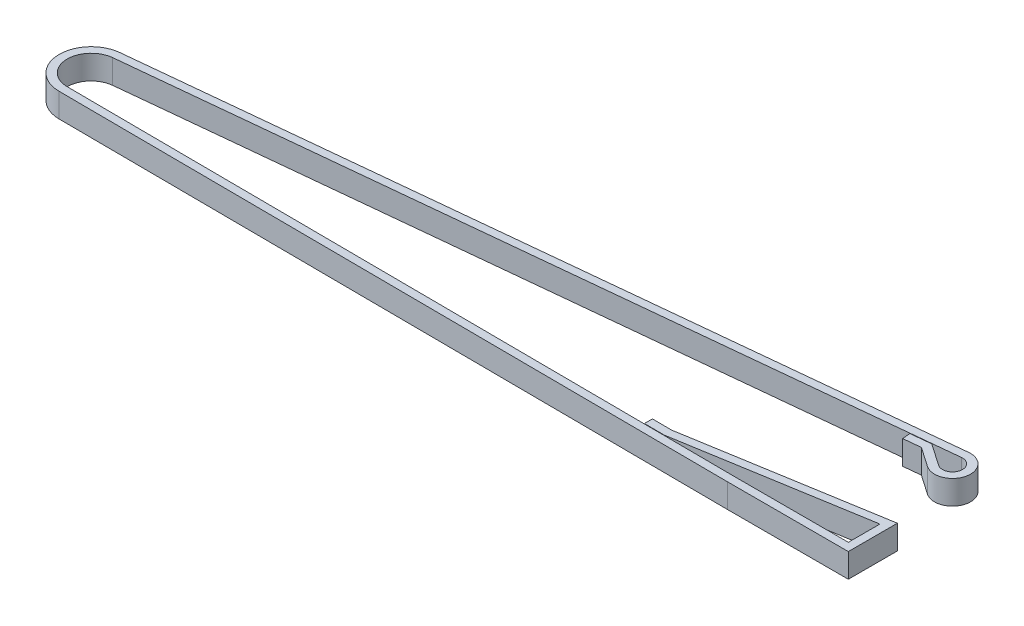
from build123d import *

# Parameters (mm, degrees)
EXTRUDE_THIN1_DEPTH = 3


with BuildPart() as part:
    # Sketch1 → Extrude-Thin1 (new, symmetric)
    with BuildSketch(Plane(origin=(0, 49.4, 0), x_dir=(1, 0, 0), z_dir=(0, 1, 0))):
        with BuildLine():
            Line((84.13477336, 49.209016257), (89.109258274, 49.713496032))
            Line((89.109258274, 49.713496032), (94.581141252, 45.941641467))
            ThreePointArc((94.581141252, 45.941641467), (98.421521165, 47.378521725), (95.747760112, 50.487242457))
            Line((95.747760112, 50.487242457), (-96.710506132, 30.969381896))
            ThreePointArc((-96.710506132, 30.969381896), (-102.09834696, 24.714771507), (-96.140865711, 19.000106419))
            Line((-96.140865711, 19.000106419), (71.775188242, 18))
            Line((71.775188242, 18), (99.975188242, 18))
            Line((99.975188242, 18), (99.975188242, 25.9))
            Line((99.975188242, 25.9), (53.816953341, 18.20696085))
            Line((53.816953341, 18.20696085), (48.816953341, 18.236740802))
            Line((48.816953341, 18.236740802), (48.82886511, 20.236705329))
            Line((48.82886511, 20.236705329), (53.65734488, 20.20794695))
            Line((53.65734488, 20.20794695), (101.975188242, 28.260920843))
            Line((101.975188242, 28.260920843), (101.975188242, 16))
            Line((101.975188242, 16), (71.769232304, 16))
            Line((71.769232304, 16), (-96.152777481, 17.000141892))
            ThreePointArc((-96.152777481, 17.000141892), (-104.096085812, 24.619695343), (-96.912298043, 32.959175862))
            Line((-96.912298043, 32.959175862), (95.545968202, 52.477036422))
            ThreePointArc((95.545968202, 52.477036422), (100.358738097, 46.881339105), (93.446054253, 44.29495464))
            Line((93.446054253, 44.29495464), (88.579542516, 47.649517336))
            Line((88.579542516, 47.649517336), (84.33656527, 47.219222292))
            Line((84.33656527, 47.219222292), (84.13477336, 49.209016257))
        make_face()
    extrude(amount=EXTRUDE_THIN1_DEPTH, both=True)


solid = part.part
